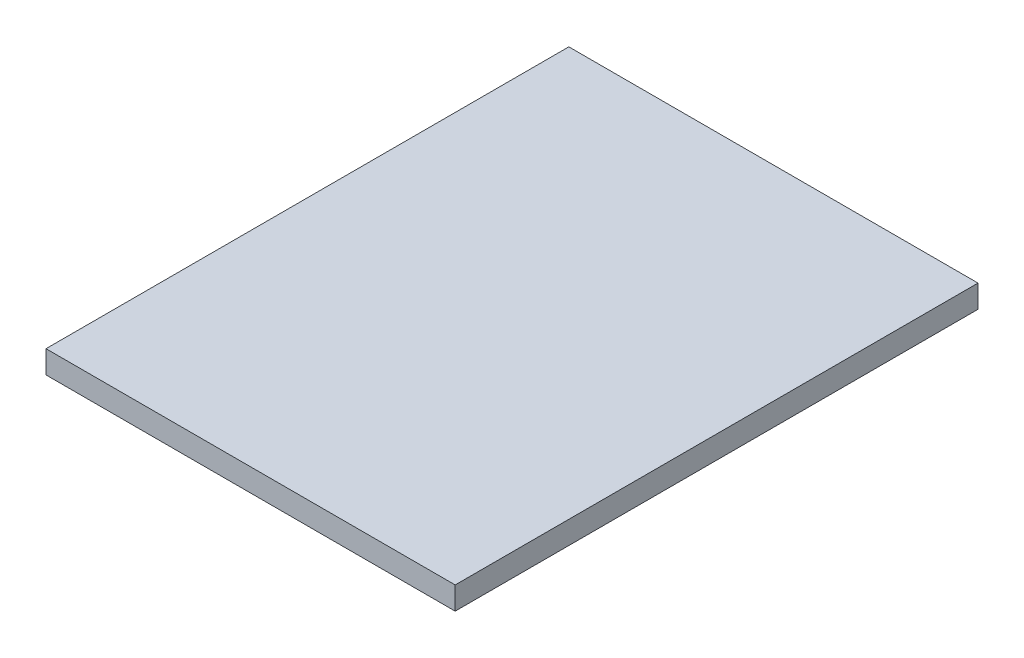
from build123d import *

# Parameters (mm, degrees)
SKETCH_1_W      = 18
SKETCH_1_H      = 23
EXTRUDE_1_DEPTH = 1


with BuildPart() as part:
    # 草圖1 → 填料-伸長1 (new body)
    with BuildSketch(Plane(origin=(0, 0, 0), x_dir=(1, 0, 0), z_dir=(0, 1, 0))):
        Rectangle(SKETCH_1_W, SKETCH_1_H)
    extrude(amount=EXTRUDE_1_DEPTH)


solid = part.part
